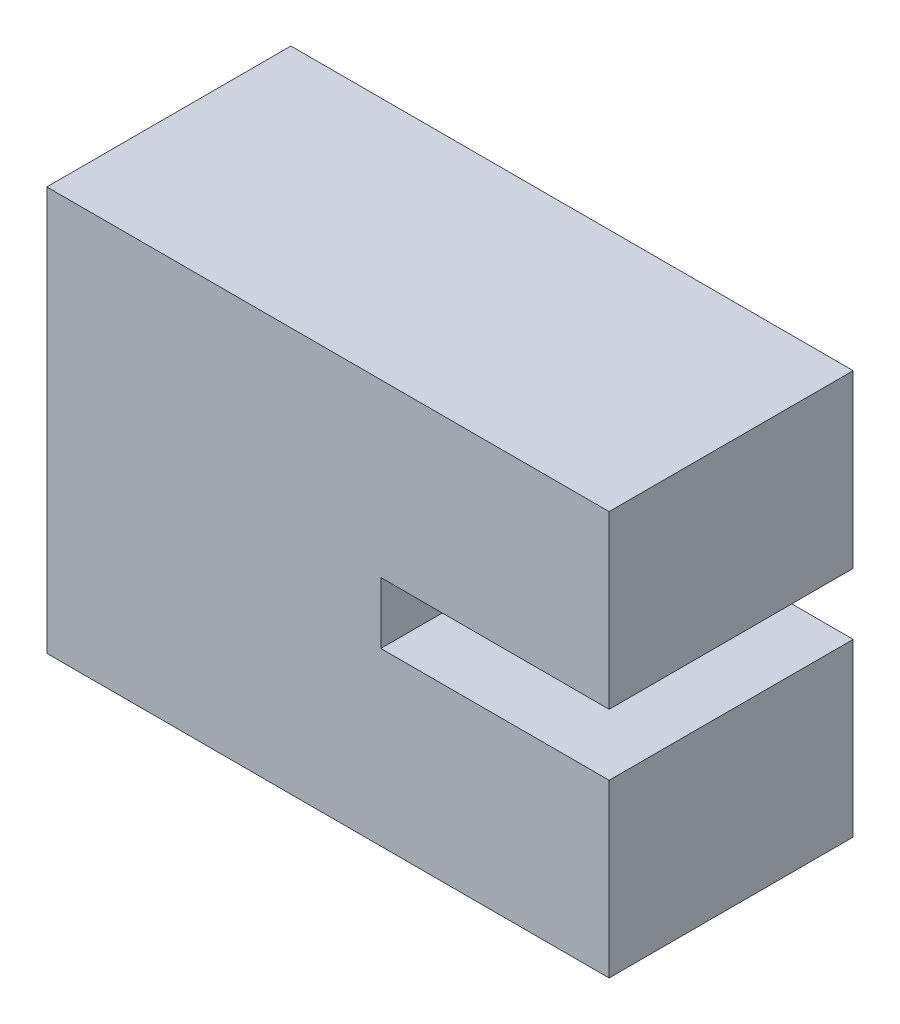
from build123d import *

# Parameters (mm, degrees)
BOSS_EXTRUDE1_DEPTH = 8.552959


with BuildPart() as part:
    # Sketch1 → Boss-Extrude1 (new body)
    with BuildSketch(Plane.XY):
        Polygon((0, 0), (0, 14.1536931), (19.704590583, 14.1536931), (19.704590583, 8.1536931), (11.704590583, 8.1536931), (11.704590583, 6), (19.704590583, 6), (19.704590583, 0), align=None)
    extrude(amount=BOSS_EXTRUDE1_DEPTH)


solid = part.part
